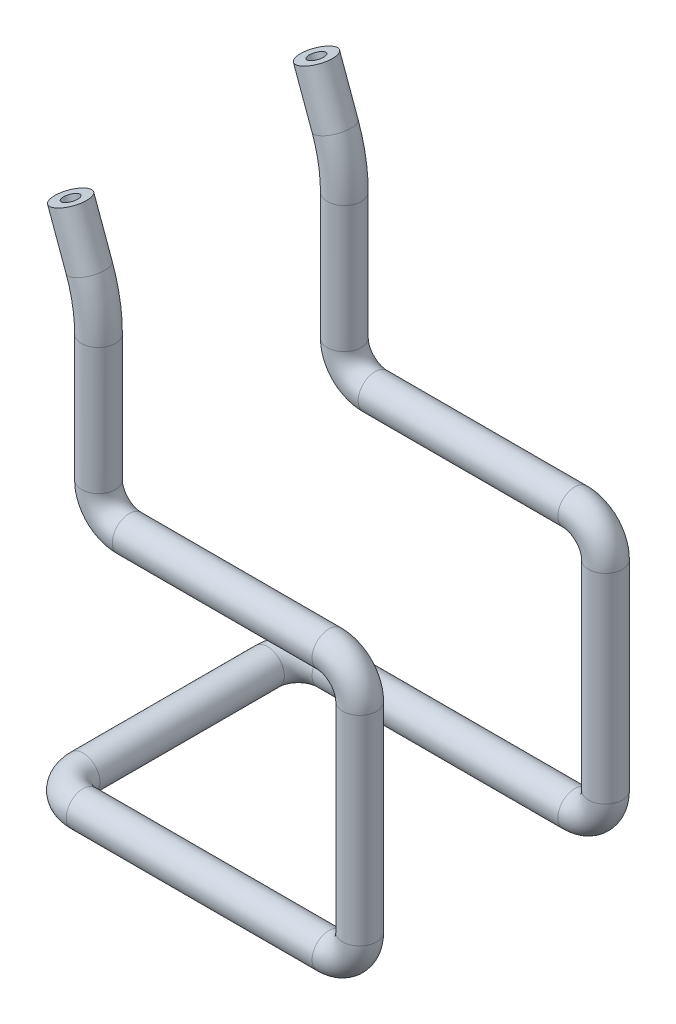
from build123d import *

# Parameters (mm, degrees)
SWEEP_THIN1_PROFILE_R   = 5.5
SWEEP_THIN1_PROFILE_R_2 = 2.5


with BuildPart() as part:
    # Sweep-Thin1: sweep along a curve in space
    with BuildLine() as sweep_thin1_path:
        Line((0, 0, 0), (0, 0, -30))
        ThreePointArc((0, 0, -30), (2.928932188, 0, -37.071067812), (10, 0, -40))
        Line((10, 0, -40), (90, 0, -40))
        ThreePointArc((90, 0, -40), (97.071067812, 2.928932188, -40), (100, 10, -40))
        Line((100, 10, -40), (100, 75, -40))
        ThreePointArc((100, 75, -40), (97.071067812, 82.071067812, -40), (90, 85, -40))
        Line((90, 85, -40), (25, 85, -40))
        ThreePointArc((25, 85, -40), (17.928932188, 87.928932188, -40), (15, 95, -40))
        Line((15, 95, -40), (15, 136.17811304, -40))
        ThreePointArc((15, 136.17811304, -40), (14.240387651, 144.860521923, -40), (11.984631039, 153.279120206, -40))
        Line((11.984631039, 153.279120206, -40), (5.936466202, 169.896316526, -40))
    # Sweep-Thin1 profile (on start of the path) → Sweep-Thin1 (sweep)
    with BuildSketch(Plane(origin=(0, 0, 0), x_dir=(-1, 0, 0), z_dir=(0, 0, -1))):
        Circle(SWEEP_THIN1_PROFILE_R)
        Circle(SWEEP_THIN1_PROFILE_R_2, mode=Mode.SUBTRACT)
    sweep_thin1 = sweep(path=sweep_thin1_path.line)

    # Mirror1: Sweep-Thin1 across plane
    add(sweep_thin1.mirror(Plane.XY))


solid = part.part
